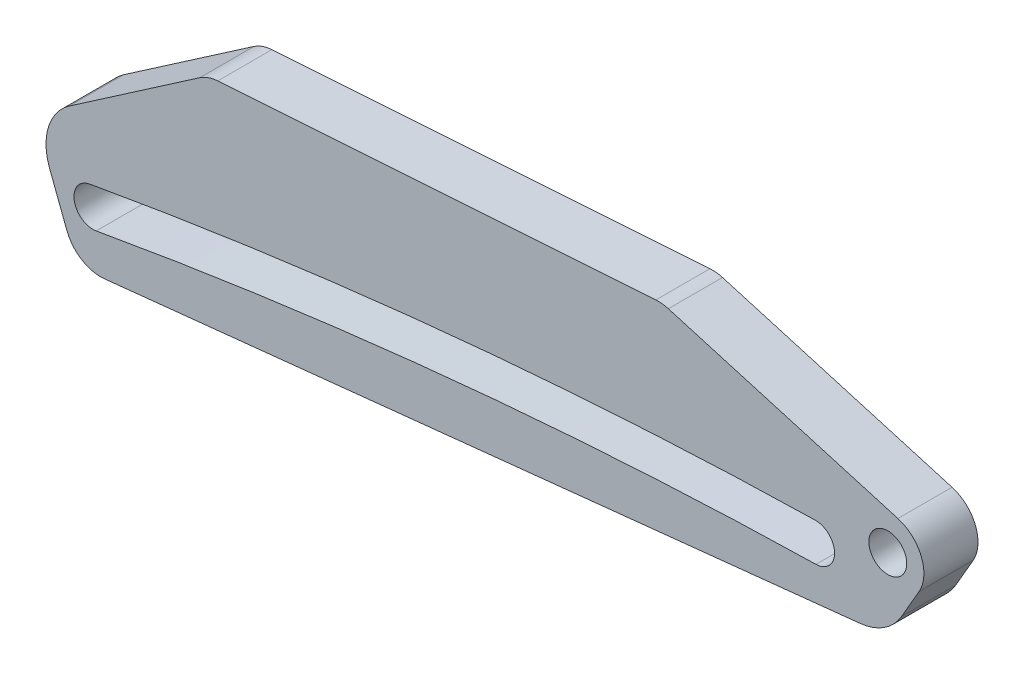
from build123d import *

# Parameters (mm, degrees)
SKETCH_1_R                 = 1.05
EXTRUDE_1_DEPTH            = 3
CUT_EXTRUDE_1_DEPTH        = 3
EXTRUDE_2_DEPTH            = 3
CUT_EXTRUDE_1_2_DEPTH      = 53.507202205
CUT_EXTRUDE_1_2_DEPTH_BACK = 3
FILLET_1_R                 = 2
FILLET_2_R                 = 3
FILLET_3_R                 = 3
FILLET_4_R                 = 2


with BuildPart() as part:
    # 草图1 → 凸台-拉伸1 (new body)
    with BuildSketch(Plane.XY):
        with BuildLine():
            Line((-49.8, -9.234190916), (-51.601705413, -5.540147386))
            Line((-51.601705413, -5.540147386), (-37.679104802, 4.039580805))
            Line((-37.679104802, 4.039580805), (-12.5, 5.72552912))
            Line((-12.5, 5.72552912), (0.559507092, 1.920143696))
            ThreePointArc((0.559507092, 1.920143696), (1.855968535, 0.745238752), (1.732050808, -1))
            Line((1.732050808, -1), (0, -4))
            Line((0, -4), (-49.8, -9.234190916))
        make_face()
        Circle(SKETCH_1_R, mode=Mode.SUBTRACT)
    extrude(amount=EXTRUDE_1_DEPTH)

    # 草图3 → Cut-Extrude 1 (cut)
    with BuildSketch(Plane.XY.offset(3)):
        with BuildLine():
            ThreePointArc((-4.02208158, -0.450232214), (-25.702985996, -1.810356042), (-47.195735426, -4.968405291))
            ThreePointArc((-47.195735426, -4.968405291), (-48.031594709, -6.195735426), (-46.804264574, -7.031594709))
            ThreePointArc((-46.804264574, -7.031594709), (-25.48441219, -3.898950185), (-3.97791842, -2.549767786))
            ThreePointArc((-3.97791842, -2.549767786), (-2.950232214, -1.47791842), (-4.02208158, -0.450232214))
        make_face()
    extrude(amount=-CUT_EXTRUDE_1_DEPTH, mode=Mode.SUBTRACT)

    # 草图5 → 凸台-拉伸2 (add)
    with BuildSketch(Plane.XY.offset(3)):
        with BuildLine():
            ThreePointArc((-44.233228768, -4.423985056), (-45.083193675, -5.64158912), (-43.865589611, -6.491554028))
            ThreePointArc((-43.865589611, -6.491554028), (-45.335706004, -6.757335859), (-46.804264574, -7.031594709))
            ThreePointArc((-46.804264574, -7.031594709), (-48.031594709, -6.195735426), (-47.195735426, -4.968405291))
            ThreePointArc((-47.195735426, -4.968405291), (-45.715267325, -4.691922292), (-44.233228768, -4.423985056))
        make_face()
    extrude(amount=-EXTRUDE_2_DEPTH)

    # 草图6 → Cut-Extrude 1 2 (cut, two sides: drawn at the far end of the back side and taken through both)
    with BuildSketch(Plane.XY.offset(3).offset(-CUT_EXTRUDE_1_2_DEPTH_BACK)):
        Polygon((-47.297047091, -2.578239778), (-44.938218964, -8.723197138), (-54.274023229, -12.306876634), (-56.632851356, -6.161919273), align=None)
    extrude(amount=CUT_EXTRUDE_1_2_DEPTH + CUT_EXTRUDE_1_2_DEPTH_BACK, mode=Mode.SUBTRACT)

    # 圆角1
    fillet_1_edges = [part.edges().sort_by_distance(p)[0] for p in [
        (-44.938218964, -8.723197138, 1.5),
    ]]
    fillet(fillet_1_edges, radius=FILLET_1_R)

    # 圆角2
    fillet_2_edges = [part.edges().sort_by_distance(p)[0] for p in [
        (0, -4, 1.5),
    ]]
    fillet(fillet_2_edges, radius=FILLET_2_R)

    # 圆角3
    fillet_3_edges = [part.edges().sort_by_distance(p)[0] for p in [
        (-47.297047091, -2.578239778, 1.5),
    ]]
    fillet(fillet_3_edges, radius=FILLET_3_R)

    # 圆角4
    fillet_4_edges = [part.edges().sort_by_distance(p)[0] for p in [
        (-12.5, 5.72552912, 1.5),
        (-37.679104802, 4.039580805, 1.5),
    ]]
    fillet(fillet_4_edges, radius=FILLET_4_R)


solid = part.part
